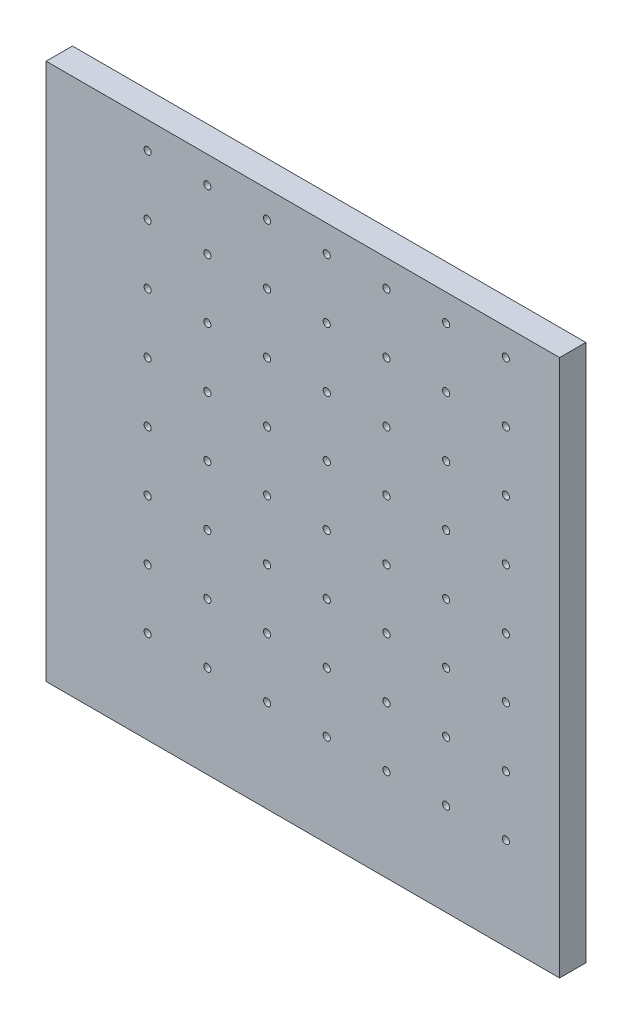
from build123d import *

# Parameters (mm, degrees)
ESQUISSE1_W             = 430
ESQUISSE1_H             = 450
BOSS_EXTRU_1_DEPTH      = 22
ENL_V_START             = -22
ESQUISSE2_W             = 250
ESQUISSE2_H             = 275
ENL_V_MAT_EXTRU_1_DEPTH = 1
ESQUISSE3_R             = 3
ENL_V_MAT_EXTRU_2_DEPTH = 623.803339747


with BuildPart() as part:
    # Esquisse1 → Boss.-Extru.1 (new body)
    with BuildSketch(Plane.XY):
        with Locations((215, 225)):
            Rectangle(ESQUISSE1_W, ESQUISSE1_H)
    extrude(amount=BOSS_EXTRU_1_DEPTH)

    # Esquisse2 → Enlèv. mat.-Extru.1 (cut)
    with BuildSketch(Plane.XY.offset(22).offset(ENL_V_START)):
        with Locations((235, 252.5)):
            Rectangle(ESQUISSE2_W, ESQUISSE2_H)
    extrude(amount=ENL_V_MAT_EXTRU_1_DEPTH, mode=Mode.SUBTRACT)

    # Esquisse3 → Enlèv. mat.-Extru.2 (cut, through all)
    with BuildSketch(Plane(origin=(0, 0, 0), x_dir=(-1, 0, 0), z_dir=(0, 0, -1))):
        with Locations((-385, 277.5)):
            Circle(ESQUISSE3_R)
        with Locations(Location((-335, 277.5, 0), (0, 0, 180))):
            Circle(ESQUISSE3_R)
        with Locations((-135, 77.5)):
            Circle(ESQUISSE3_R)
        with Locations(Location((-85, 77.5, 0), (0, 0, 180))):
            Circle(ESQUISSE3_R)
        with Locations(Location((-185, 77.5, 0), (0, 0, 180))):
            Circle(ESQUISSE3_R)
        with Locations((-285, 77.5)):
            Circle(ESQUISSE3_R)
        with Locations((-285, 277.5)):
            Circle(ESQUISSE3_R)
        with Locations(Location((-235, 277.5, 0), (0, 0, 180))):
            Circle(ESQUISSE3_R)
        with Locations(Location((-185, 277.5, 0), (0, 0, 180))):
            Circle(ESQUISSE3_R)
        with Locations(Location((-235, 77.5, 0), (0, 0, 180))):
            Circle(ESQUISSE3_R)
        with Locations((-385, 77.5)):
            Circle(ESQUISSE3_R)
        with Locations(Location((-335, 77.5, 0), (0, 0, 180))):
            Circle(ESQUISSE3_R)
        with Locations((-135, 277.5)):
            Circle(ESQUISSE3_R)
        with Locations(Location((-85, 277.5, 0), (0, 0, 180))):
            Circle(ESQUISSE3_R)
        with Locations((-85, 327.5)):
            Circle(ESQUISSE3_R)
        with Locations(Location((-135, 327.5, 0), (0, 0, 180))):
            Circle(ESQUISSE3_R)
        with Locations((-135, 377.5)):
            Circle(ESQUISSE3_R)
        with Locations(Location((-85, 377.5, 0), (0, 0, 180))):
            Circle(ESQUISSE3_R)
        with Locations(Location((-185, 377.5, 0), (0, 0, 180))):
            Circle(ESQUISSE3_R)
        with Locations((-185, 327.5)):
            Circle(ESQUISSE3_R)
        with Locations((-235, 327.5)):
            Circle(ESQUISSE3_R)
        with Locations(Location((-285, 327.5, 0), (0, 0, 180))):
            Circle(ESQUISSE3_R)
        with Locations((-285, 377.5)):
            Circle(ESQUISSE3_R)
        with Locations(Location((-235, 377.5, 0), (0, 0, 180))):
            Circle(ESQUISSE3_R)
        with Locations((-385, 377.5)):
            Circle(ESQUISSE3_R)
        with Locations(Location((-335, 377.5, 0), (0, 0, 180))):
            Circle(ESQUISSE3_R)
        with Locations((-335, 327.5)):
            Circle(ESQUISSE3_R)
        with Locations(Location((-385, 327.5, 0), (0, 0, 180))):
            Circle(ESQUISSE3_R)
        with Locations((-385, 177.5)):
            Circle(ESQUISSE3_R)
        with Locations(Location((-335, 177.5, 0), (0, 0, 180))):
            Circle(ESQUISSE3_R)
        with Locations((-335, 127.5)):
            Circle(ESQUISSE3_R)
        with Locations(Location((-385, 127.5, 0), (0, 0, 180))):
            Circle(ESQUISSE3_R)
        with Locations((-235, 127.5)):
            Circle(ESQUISSE3_R)
        with Locations(Location((-285, 127.5, 0), (0, 0, 180))):
            Circle(ESQUISSE3_R)
        with Locations((-285, 177.5)):
            Circle(ESQUISSE3_R)
        with Locations(Location((-235, 177.5, 0), (0, 0, 180))):
            Circle(ESQUISSE3_R)
        with Locations(Location((-185, 177.5, 0), (0, 0, 180))):
            Circle(ESQUISSE3_R)
        with Locations((-185, 127.5)):
            Circle(ESQUISSE3_R)
        with Locations((-85, 127.5)):
            Circle(ESQUISSE3_R)
        with Locations(Location((-135, 127.5, 0), (0, 0, 180))):
            Circle(ESQUISSE3_R)
        with Locations((-135, 177.5)):
            Circle(ESQUISSE3_R)
        with Locations(Location((-85, 177.5, 0), (0, 0, 180))):
            Circle(ESQUISSE3_R)
        with Locations((-85, 227.5)):
            Circle(ESQUISSE3_R)
        with Locations(Location((-135, 227.5, 0), (0, 0, 180))):
            Circle(ESQUISSE3_R)
        with Locations((-185, 227.5)):
            Circle(ESQUISSE3_R)
        with Locations((-235, 227.5)):
            Circle(ESQUISSE3_R)
        with Locations(Location((-285, 227.5, 0), (0, 0, 180))):
            Circle(ESQUISSE3_R)
        with Locations((-335, 227.5)):
            Circle(ESQUISSE3_R)
        with Locations(Location((-385, 227.5, 0), (0, 0, 180))):
            Circle(ESQUISSE3_R)
        with Locations((-335, 427.5)):
            Circle(ESQUISSE3_R)
        with Locations(Location((-385, 427.5, 0), (0, 0, 180))):
            Circle(ESQUISSE3_R)
        with Locations((-235, 427.5)):
            Circle(ESQUISSE3_R)
        with Locations(Location((-285, 427.5, 0), (0, 0, 180))):
            Circle(ESQUISSE3_R)
        with Locations((-185, 427.5)):
            Circle(ESQUISSE3_R)
        with Locations((-85, 427.5)):
            Circle(ESQUISSE3_R)
        with Locations(Location((-135, 427.5, 0), (0, 0, 180))):
            Circle(ESQUISSE3_R)
    extrude(amount=-ENL_V_MAT_EXTRU_2_DEPTH, mode=Mode.SUBTRACT)


solid = part.part
